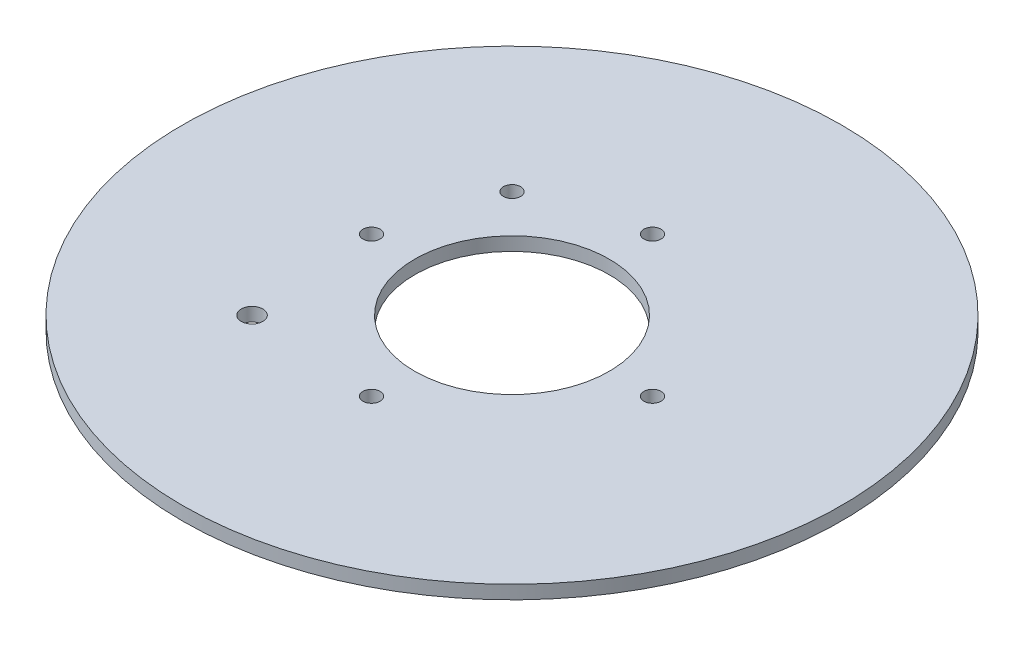
from build123d import *

# Parameters (mm, degrees)
SKETCH1_R           = 77.4600051
BOSS_EXTRUDE1_DEPTH = 3.175
SKETCH20_R          = 22.86
SKETCH20_R_2        = 2.0193
CUT_EXTRUDE10_DEPTH = 251.865681086
SKETCH21_R          = 2.0193
CUT_EXTRUDE11_DEPTH = 251.865681086
SKETCH23_R          = 2.54
CUT_EXTRUDE13_DEPTH = 3.175


with BuildPart() as part:
    # Sketch1 → Boss-Extrude1 (new body)
    with BuildSketch(Plane(origin=(0, 0, 0), x_dir=(1, 0, 0), z_dir=(0, 1, 0))):
        with Locations(Location((0, 0, 0), (0, 0, 270))):
            Circle(SKETCH1_R)
    extrude(amount=BOSS_EXTRUDE1_DEPTH)

    # Sketch20 → Cut-Extrude10 (cut, through all)
    with BuildSketch(Plane(origin=(-73.768816189, 25.4, -121.080352405), x_dir=(1, 0, 0), z_dir=(0, 1, 0))):
        with Locations(Location((73.768816189, -121.080352405, 0), (0, 0, 270))):
            Circle(SKETCH20_R)
        with Locations(Location((73.768816189, -88.060352405, 0), (0, 0, 270))):
            Circle(SKETCH20_R_2)
        with Locations(Location((106.788816189, -121.080352405, 0), (0, 0, 270))):
            Circle(SKETCH20_R_2)
        with Locations(Location((73.768816189, -154.100352405, 0), (0, 0, 270))):
            Circle(SKETCH20_R_2)
        with Locations(Location((40.748816189, -121.080352405, 0), (0, 0, 270))):
            Circle(SKETCH20_R_2)
    extrude(amount=-CUT_EXTRUDE10_DEPTH, mode=Mode.SUBTRACT)

    # Sketch21 → Cut-Extrude11 (cut, through all)
    with BuildSketch(Plane(origin=(-73.768816189, 25.4, -121.080352405), x_dir=(1, 0, 0), z_dir=(0, 1, 0))):
        with Locations(Location((48.605023435, -95.916559651, 0), (0, 0, 270))):
            Circle(SKETCH21_R)
    extrude(amount=-CUT_EXTRUDE11_DEPTH, mode=Mode.SUBTRACT)

    # Sketch23 → Cut-Extrude13 (cut)
    with BuildSketch(Plane(origin=(-73.768816189, 0, -121.080352405), x_dir=(1, 0, 0), z_dir=(0, -1, 0))):
        with Locations(Location((43.216869762, 151.632298832, 0), (0, 0, 270))):
            Circle(SKETCH23_R)
    extrude(amount=-CUT_EXTRUDE13_DEPTH, mode=Mode.SUBTRACT)


solid = part.part
